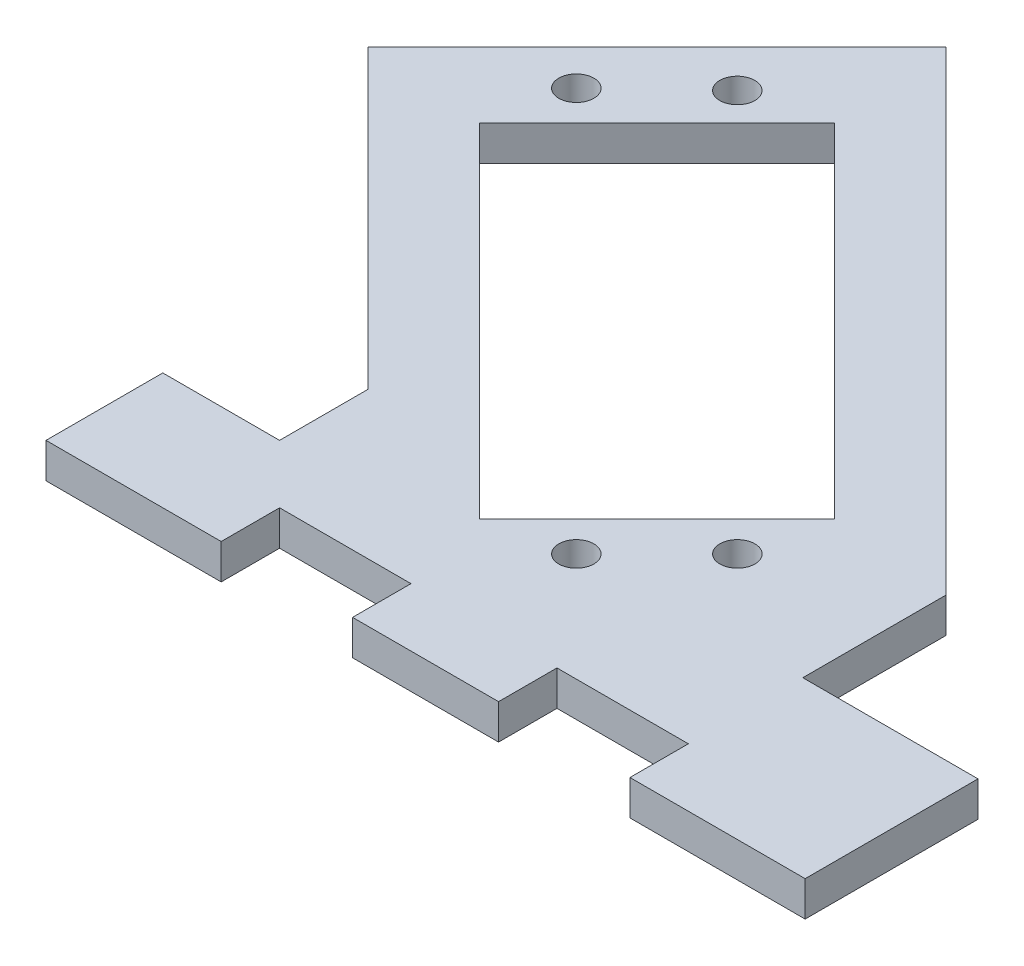
from build123d import *

# Parameters (mm, degrees)
SKETCH_1_R      = 1.5
EXTRUDE_1_DEPTH = 3


with BuildPart() as part:
    # 草图1 → 凸台-拉伸1 (new body)
    with BuildSketch(Plane(origin=(0, 0, 0), x_dir=(1, 0, 0), z_dir=(0, 1, 0))):
        Polygon((-14.3760191, 4.830077554), (-14.3760191, -2.722447763), (-24.3760191, -2.722447763), (-24.3760191, -12.722447763), (-9.3760191, -12.722447763), (-9.3760191, -7.722447763), (1.8739809, -7.722447763), (1.8739809, -12.722447763), (14.3739809, -12.722447763), (14.3739809, -7.722447763), (25.6239809, -7.722447763), (25.6239809, -12.722447763), (40.6239809, -12.722447763), (40.6239809, 2.077552237), (25.6239809, 2.077552237), (25.6239809, 14.327552237), (-15.0260191, 54.977552237), (-39.774756442, 30.228814896), align=None)
        with Locations(Location((-27.784627569, 36.093132248, 0), (0, 0, 270))):
            Circle(SKETCH_1_R, mode=Mode.SUBTRACT)
        with Locations(Location((-20.724931121, 42.817950912, 0), (0, 0, 270))):
            Circle(SKETCH_1_R, mode=Mode.SUBTRACT)
        with Locations(Location((6.748200828, 1.560303851, 0), (0, 0, 270))):
            Circle(SKETCH_1_R, mode=Mode.SUBTRACT)
        with Locations(Location((13.642491945, 8.454594967, 0), (0, 0, 270))):
            Circle(SKETCH_1_R, mode=Mode.SUBTRACT)
        Polygon((0, 0), (15.202795796, 15.202795796), (-14.142135624, 44.547727215), (-29.344931419, 29.344931419), align=None, mode=Mode.SUBTRACT)
    extrude(amount=EXTRUDE_1_DEPTH)


solid = part.part
